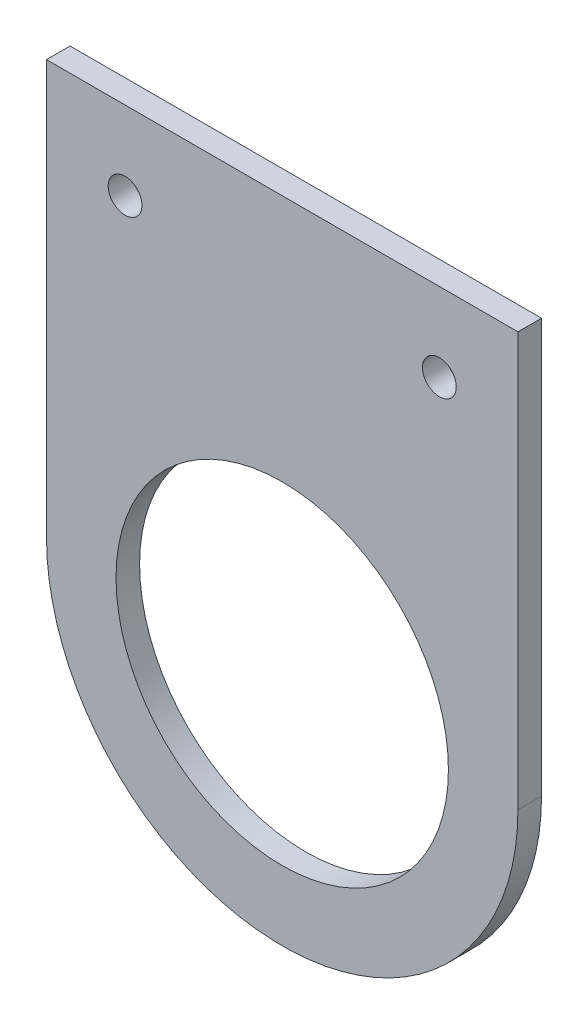
from build123d import *

# Parameters (mm, degrees)
SKETCH_1_R      = 21.15
SKETCH_1_R_2    = 2.15
EXTRUDE_1_DEPTH = 3


with BuildPart() as part:
    # 草图1 → 凸台-拉伸1 (new body)
    with BuildSketch(Plane.XY):
        with BuildLine():
            Line((-30, 0), (-30, 52.68))
            Line((-30, 52.68), (30, 52.68))
            Line((30, 52.68), (30, 0))
            ThreePointArc((30, 0), (0, -30), (-30, 0))
        make_face()
        Circle(SKETCH_1_R, mode=Mode.SUBTRACT)
        with Locations((-20, 42.68)):
            Circle(SKETCH_1_R_2, mode=Mode.SUBTRACT)
        with Locations((20, 42.68)):
            Circle(SKETCH_1_R_2, mode=Mode.SUBTRACT)
    extrude(amount=EXTRUDE_1_DEPTH)


solid = part.part
